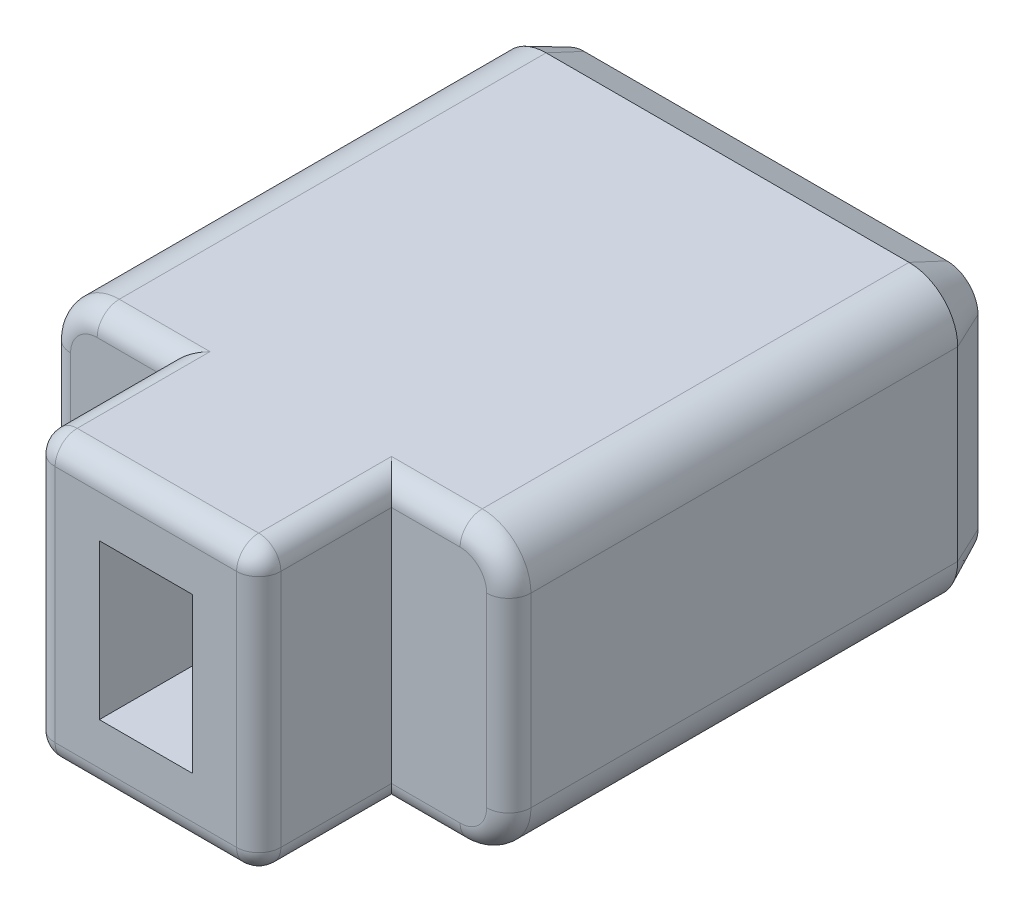
from build123d import *

# Parameters (mm, degrees)
BOSS_EXTRU_1_DEPTH      = 14
ESQUISSE3_W             = 2.1
ESQUISSE3_H             = 3.5
ENL_V_MAT_EXTRU_1_DEPTH = 3
ESQUISSE4_OUTSIDE_W     = 16.116
ESQUISSE4_OUTSIDE_H     = 12.116
ESQUISSE4_OUTSIDE_W_2   = 5.1
ESQUISSE4_OUTSIDE_H_2   = 6.4
ENL_V_MAT_EXTRU_2_DEPTH = 3
CONG_1_R                = 0.5
CHANFREIN1_SIZE         = 0.4
CHANFREIN1_SIZE2        = 0.857802768
ENL_V_MAT_EXTRU_3_DEPTH = 0.3
BOSS_EXTRU_2_DEPTH      = 0.3
BOSS_EXTRU_2_2_DEPTH    = 0.3
BOSS_EXTRU_2_3_DEPTH    = 0.3


with BuildPart() as part:
    # Esquisse2 → Boss.-Extru.1 (new body)
    with BuildSketch(Plane.XY):
        with BuildLine():
            Line((1.1, 0), (9.3, 0))
            ThreePointArc((9.3, 0), (10.077817459, 0.322182541), (10.4, 1.1))
            Line((10.4, 1.1), (10.4, 5.3))
            ThreePointArc((10.4, 5.3), (10.077817459, 6.077817459), (9.3, 6.4))
            Line((9.3, 6.4), (1.1, 6.4))
            ThreePointArc((1.1, 6.4), (0.322182541, 6.077817459), (0, 5.3))
            Line((0, 5.3), (0, 1.1))
            ThreePointArc((0, 1.1), (0.322182541, 0.322182541), (1.1, 0))
        make_face()
    extrude(amount=BOSS_EXTRU_1_DEPTH)

    # Esquisse3 → Enlèv. mat.-Extru.1 (cut)
    with BuildSketch(Plane.XY.offset(14)):
        with Locations((5.2, 3.2)):
            Rectangle(ESQUISSE3_W, ESQUISSE3_H)
    extrude(amount=-ENL_V_MAT_EXTRU_1_DEPTH, mode=Mode.SUBTRACT)

    # Esquisse4 outside → Enlèv. mat.-Extru.2 (cut)
    with BuildSketch(Plane.XY.offset(14)):
        with Locations((5.2, 3.2)):
            Rectangle(ESQUISSE4_OUTSIDE_W, ESQUISSE4_OUTSIDE_H)
        with Locations((5.2, 3.2)):
            Rectangle(ESQUISSE4_OUTSIDE_W_2, ESQUISSE4_OUTSIDE_H_2, mode=Mode.SUBTRACT)
    extrude(amount=-ENL_V_MAT_EXTRU_2_DEPTH, mode=Mode.SUBTRACT)

    # Congé1
    cong_1_edges = [part.edges().sort_by_distance(p)[0] for p in [
        (8.525, 0, 11),
        (10.077817459, 0.322182541, 11),
        (10.4, 3.2, 11),
        (10.077817459, 6.077817459, 11),
        (1.875, 6.4, 11),
        (0.322182541, 6.077817459, 11),
        (1.875, 0, 11),
        (0.322182541, 0.322182541, 11),
        (7.75, 6.4, 12.5),
        (2.65, 6.4, 12.5),
        (7.75, 0, 12.5),
        (2.65, 0, 12.5),
        (2.65, 3.2, 14),
        (5.2, 6.4, 14),
        (7.75, 3.2, 14),
        (5.2, 0, 14),
        (8.525, 6.4, 11),
        (0, 3.2, 11),
    ]]
    fillet(cong_1_edges, radius=CONG_1_R)

    # Chanfrein1
    chanfrein1_edges = [part.edges().sort_by_distance(p)[0] for p in [
        (5.2, 0, 0),
        (10.077817459, 0.322182541, 0),
        (0.322182541, 0.322182541, 0),
        (10.4, 3.2, 0),
        (0, 3.2, 0),
        (10.077817459, 6.077817459, 0),
        (0.322182541, 6.077817459, 0),
        (5.2, 6.4, 0),
    ]]
    chanfrein1_side = [part.faces().sort_by_distance(p)[0] for p in [
        (5.2, 3.2, 0),
    ]]
    chamfer(chanfrein1_edges, length=CHANFREIN1_SIZE, length2=CHANFREIN1_SIZE2, reference=chanfrein1_side[0])

    # Esquisse5 → Enlèv. mat.-Extru.3 (cut)
    # profile 1 of 3: a face of its own
    with BuildSketch(Plane(origin=(0, 0, 0), x_dir=(-1, 0, 0), z_dir=(0, 0, -1))):
        Polygon((-1.020512821, 1.3), (-1.409935897, 1.3), (-2.533333333, 4.322435897), (-3.656730769, 1.3), (-4.046153846, 1.3), (-2.558974359, 5.3), (-2.507692308, 5.3), align=None)
    # profile 2 of 3: a face of its own
    with BuildSketch(Plane(origin=(0, 0, 0), x_dir=(-1, 0, 0), z_dir=(0, 0, -1))):
        Polygon((-4.661538462, 1.3), (-6.405128205, 1.3), (-6.405128205, 1.71025641), (-5.020512821, 1.71025641), (-5.020512821, 2.941025641), (-6.405128205, 2.941025641), (-6.405128205, 3.351282051), (-5.020512821, 3.351282051), (-5.020512821, 5.3), (-4.661538462, 5.3), align=None)
    # profile 3 of 3: a face of its own
    with BuildSketch(Plane(origin=(0, 0, 0), x_dir=(-1, 0, 0), z_dir=(0, 0, -1))):
        with BuildLine():
            Line((-7.020512821, 1.3), (-7.722435897, 1.3))
            add(Edge.make_bspline(
                [(-7.722435897, 1.3), (-7.769444044, 1.3001758), (-7.859460733, 1.300512444), (-7.98851141, 1.30243476), (-8.105730858, 1.307883219), (-8.211345573, 1.312567873), (-8.305040018, 1.321160882), (-8.386952018, 1.329228391), (-8.457062524, 1.340225169), (-8.499455919, 1.350001033), (-8.518910256, 1.354487179)],
                knots=[0, 0, 0, 0, 1.410548186, 2.701082353, 3.872164956, 4.931545487, 5.872643019, 6.694846481, 7.4010648, 8, 8, 8, 8], degree=3))
            add(Edge.make_bspline(
                [(-8.518910256, 1.354487179), (-8.544449911, 1.361740702), (-8.595248098, 1.376167905), (-8.668176885, 1.406439045), (-8.737984809, 1.441506074), (-8.804254063, 1.482432658), (-8.865952127, 1.530293066), (-8.924705291, 1.583010705), (-8.979138515, 1.642142742), (-9.030806021, 1.705691029), (-9.07573812, 1.775470425), (-9.116420173, 1.84848438), (-9.150056558, 1.926168245), (-9.177875311, 2.007354342), (-9.199875162, 2.092501008), (-9.214858707, 2.181499618), (-9.223649327, 2.274448402), (-9.224970525, 2.337641421), (-9.225641026, 2.369711538)],
                knots=[0, 0, 0, 0, 0.953163587, 1.89583545, 2.831398256, 3.758060157, 4.68893587, 5.633315694, 6.590672633, 7.573797765, 8.571889309, 9.568272541, 10.573809546, 11.608637311, 12.649011887, 13.729676081, 14.847822807, 16, 16, 16, 16], degree=3))
            add(Edge.make_bspline(
                [(-9.225641026, 2.369711538), (-9.223893826, 2.422954138), (-9.220493564, 2.526570717), (-9.195623105, 2.677261673), (-9.152594929, 2.81754481), (-9.094826437, 2.948255807), (-9.019033028, 3.065244445), (-8.929392987, 3.169018947), (-8.823804298, 3.255709115), (-8.7252966, 3.316142217), (-8.638143734, 3.354829067), (-8.566724935, 3.381850513), (-8.488430711, 3.402787801), (-8.404794577, 3.421281099), (-8.315168735, 3.43568177), (-8.219689407, 3.445914246), (-8.118089984, 3.452378952), (-8.048300475, 3.453348696), (-8.0125, 3.453846154)],
                knots=[0, 0, 0, 0, 1.376217794, 2.678287309, 3.93428021, 5.161237768, 6.360266741, 7.524963188, 8.691990789, 9.878588042, 10.499780802, 11.155222415, 11.850483239, 12.59271203, 13.369193386, 14.195792071, 15.07448124, 16, 16, 16, 16], degree=3))
            Line((-8.0125, 3.453846154), (-9.276923077, 5.3))
            Line((-9.276923077, 5.3), (-8.821794872, 5.3))
            Line((-8.821794872, 5.3), (-7.557371795, 3.453846154))
            Line((-7.557371795, 3.453846154), (-7.379487179, 3.453846154))
            Line((-7.379487179, 3.453846154), (-7.379487179, 5.3))
            Line((-7.379487179, 5.3), (-7.020512821, 5.3))
            Line((-7.020512821, 5.3), (-7.020512821, 1.3))
        make_face()
        with BuildLine():
            Line((-7.379487179, 1.71025641), (-7.379487179, 3.043589744))
            Line((-7.379487179, 3.043589744), (-7.986057692, 3.049198718))
            add(Edge.make_bspline(
                [(-7.986057692, 3.049198718), (-8.014377096, 3.049210151), (-8.069445102, 3.049232382), (-8.149040024, 3.044690832), (-8.223110765, 3.039498774), (-8.291299395, 3.031522413), (-8.353897551, 3.021209602), (-8.410706433, 3.008671123), (-8.461841651, 2.993317462), (-8.521732472, 2.970298044), (-8.589657205, 2.934767812), (-8.660639371, 2.879433289), (-8.722878991, 2.813395636), (-8.773853172, 2.736538502), (-8.816342693, 2.652636038), (-8.844073081, 2.561970672), (-8.864196625, 2.46728064), (-8.865832215, 2.402142615), (-8.866666667, 2.368910256)],
                knots=[0, 0, 0, 0, 1.065115818, 2.071152542, 2.998223466, 3.858177936, 4.652718105, 5.384003046, 6.045176779, 6.659081028, 7.796261142, 8.913693857, 10.029725289, 11.194622041, 12.371932755, 13.553993211, 14.752087226, 16, 16, 16, 16], degree=3))
            add(Edge.make_bspline(
                [(-8.866666667, 2.368910256), (-8.865764306, 2.336760519), (-8.863981554, 2.273243778), (-8.844517895, 2.180651775), (-8.814844306, 2.092194398), (-8.773674906, 2.009394504), (-8.721694276, 1.935229452), (-8.66202568, 1.870951797), (-8.594523077, 1.818145247), (-8.531641052, 1.782945664), (-8.474830382, 1.762101483), (-8.426269991, 1.747469387), (-8.370891417, 1.736739671), (-8.309408708, 1.727226354), (-8.241278933, 1.71912867), (-8.166688714, 1.713725393), (-8.085713296, 1.710490094), (-8.029597271, 1.710336239), (-8.000480769, 1.71025641)],
                knots=[0, 0, 0, 0, 1.233968552, 2.43789431, 3.619555944, 4.813196433, 5.977971186, 7.089174201, 8.171406254, 9.260239712, 9.841766941, 10.494663619, 11.20736683, 12.007361027, 12.8859566, 13.843359851, 14.8810003, 16, 16, 16, 16], degree=3))
            Line((-8.000480769, 1.71025641), (-7.379487179, 1.71025641))
        make_face(mode=Mode.SUBTRACT)
    extrude(amount=-ENL_V_MAT_EXTRU_3_DEPTH, mode=Mode.SUBTRACT)


with BuildPart() as body_2:
    # Esquisse5<2> → Boss.-Extru.2 (new body)
    with BuildSketch(Plane(origin=(0, 0, 0), x_dir=(-1, 0, 0), z_dir=(0, 0, -1))):
        Polygon((-1.020512821, 1.3), (-1.409935897, 1.3), (-2.533333333, 4.322435897), (-3.656730769, 1.3), (-4.046153846, 1.3), (-2.558974359, 5.3), (-2.507692308, 5.3), align=None)
    extrude(amount=BOSS_EXTRU_2_DEPTH)


with BuildPart() as body_3:
    # Esquisse5<2> → Boss.-Extru.2 2 (new body)
    with BuildSketch(Plane(origin=(0, 0, 0), x_dir=(-1, 0, 0), z_dir=(0, 0, -1))):
        Polygon((-4.661538462, 1.3), (-6.405128205, 1.3), (-6.405128205, 1.71025641), (-5.020512821, 1.71025641), (-5.020512821, 2.941025641), (-6.405128205, 2.941025641), (-6.405128205, 3.351282051), (-5.020512821, 3.351282051), (-5.020512821, 5.3), (-4.661538462, 5.3), align=None)
    extrude(amount=BOSS_EXTRU_2_2_DEPTH)


with BuildPart() as body_4:
    # Esquisse5<2> → Boss.-Extru.2 3 (new body)
    with BuildSketch(Plane(origin=(0, 0, 0), x_dir=(-1, 0, 0), z_dir=(0, 0, -1))):
        with BuildLine():
            Line((-7.020512821, 1.3), (-7.722435897, 1.3))
            add(Edge.make_bspline(
                [(-7.722435897, 1.3), (-7.769444044, 1.3001758), (-7.859460733, 1.300512444), (-7.98851141, 1.30243476), (-8.105730858, 1.307883219), (-8.211345573, 1.312567873), (-8.305040018, 1.321160882), (-8.386952018, 1.329228391), (-8.457062524, 1.340225169), (-8.499455919, 1.350001033), (-8.518910256, 1.354487179)],
                knots=[0, 0, 0, 0, 1.410548186, 2.701082353, 3.872164956, 4.931545487, 5.872643019, 6.694846481, 7.4010648, 8, 8, 8, 8], degree=3))
            add(Edge.make_bspline(
                [(-8.518910256, 1.354487179), (-8.544449911, 1.361740702), (-8.595248098, 1.376167905), (-8.668176885, 1.406439045), (-8.737984809, 1.441506074), (-8.804254063, 1.482432658), (-8.865952127, 1.530293066), (-8.924705291, 1.583010705), (-8.979138515, 1.642142742), (-9.030806021, 1.705691029), (-9.07573812, 1.775470425), (-9.116420173, 1.84848438), (-9.150056558, 1.926168245), (-9.177875311, 2.007354342), (-9.199875162, 2.092501008), (-9.214858707, 2.181499618), (-9.223649327, 2.274448402), (-9.224970525, 2.337641421), (-9.225641026, 2.369711538)],
                knots=[0, 0, 0, 0, 0.953163587, 1.89583545, 2.831398256, 3.758060157, 4.68893587, 5.633315694, 6.590672633, 7.573797765, 8.571889309, 9.568272541, 10.573809546, 11.608637311, 12.649011887, 13.729676081, 14.847822807, 16, 16, 16, 16], degree=3))
            add(Edge.make_bspline(
                [(-9.225641026, 2.369711538), (-9.223893826, 2.422954138), (-9.220493564, 2.526570717), (-9.195623105, 2.677261673), (-9.152594929, 2.81754481), (-9.094826437, 2.948255807), (-9.019033028, 3.065244445), (-8.929392987, 3.169018947), (-8.823804298, 3.255709115), (-8.7252966, 3.316142217), (-8.638143734, 3.354829067), (-8.566724935, 3.381850513), (-8.488430711, 3.402787801), (-8.404794577, 3.421281099), (-8.315168735, 3.43568177), (-8.219689407, 3.445914246), (-8.118089984, 3.452378952), (-8.048300475, 3.453348696), (-8.0125, 3.453846154)],
                knots=[0, 0, 0, 0, 1.376217794, 2.678287309, 3.93428021, 5.161237768, 6.360266741, 7.524963188, 8.691990789, 9.878588042, 10.499780802, 11.155222415, 11.850483239, 12.59271203, 13.369193386, 14.195792071, 15.07448124, 16, 16, 16, 16], degree=3))
            Line((-8.0125, 3.453846154), (-9.276923077, 5.3))
            Line((-9.276923077, 5.3), (-8.821794872, 5.3))
            Line((-8.821794872, 5.3), (-7.557371795, 3.453846154))
            Line((-7.557371795, 3.453846154), (-7.379487179, 3.453846154))
            Line((-7.379487179, 3.453846154), (-7.379487179, 5.3))
            Line((-7.379487179, 5.3), (-7.020512821, 5.3))
            Line((-7.020512821, 5.3), (-7.020512821, 1.3))
        make_face()
        with BuildLine():
            Line((-7.379487179, 1.71025641), (-7.379487179, 3.043589744))
            Line((-7.379487179, 3.043589744), (-7.986057692, 3.049198718))
            add(Edge.make_bspline(
                [(-7.986057692, 3.049198718), (-8.014377096, 3.049210151), (-8.069445102, 3.049232382), (-8.149040024, 3.044690832), (-8.223110765, 3.039498774), (-8.291299395, 3.031522413), (-8.353897551, 3.021209602), (-8.410706433, 3.008671123), (-8.461841651, 2.993317462), (-8.521732472, 2.970298044), (-8.589657205, 2.934767812), (-8.660639371, 2.879433289), (-8.722878991, 2.813395636), (-8.773853172, 2.736538502), (-8.816342693, 2.652636038), (-8.844073081, 2.561970672), (-8.864196625, 2.46728064), (-8.865832215, 2.402142615), (-8.866666667, 2.368910256)],
                knots=[0, 0, 0, 0, 1.065115818, 2.071152542, 2.998223466, 3.858177936, 4.652718105, 5.384003046, 6.045176779, 6.659081028, 7.796261142, 8.913693857, 10.029725289, 11.194622041, 12.371932755, 13.553993211, 14.752087226, 16, 16, 16, 16], degree=3))
            add(Edge.make_bspline(
                [(-8.866666667, 2.368910256), (-8.865764306, 2.336760519), (-8.863981554, 2.273243778), (-8.844517895, 2.180651775), (-8.814844306, 2.092194398), (-8.773674906, 2.009394504), (-8.721694276, 1.935229452), (-8.66202568, 1.870951797), (-8.594523077, 1.818145247), (-8.531641052, 1.782945664), (-8.474830382, 1.762101483), (-8.426269991, 1.747469387), (-8.370891417, 1.736739671), (-8.309408708, 1.727226354), (-8.241278933, 1.71912867), (-8.166688714, 1.713725393), (-8.085713296, 1.710490094), (-8.029597271, 1.710336239), (-8.000480769, 1.71025641)],
                knots=[0, 0, 0, 0, 1.233968552, 2.43789431, 3.619555944, 4.813196433, 5.977971186, 7.089174201, 8.171406254, 9.260239712, 9.841766941, 10.494663619, 11.20736683, 12.007361027, 12.8859566, 13.843359851, 14.8810003, 16, 16, 16, 16], degree=3))
            Line((-8.000480769, 1.71025641), (-7.379487179, 1.71025641))
        make_face(mode=Mode.SUBTRACT)
    extrude(amount=BOSS_EXTRU_2_3_DEPTH)


solid = Compound([part.part, body_2.part, body_3.part, body_4.part])
